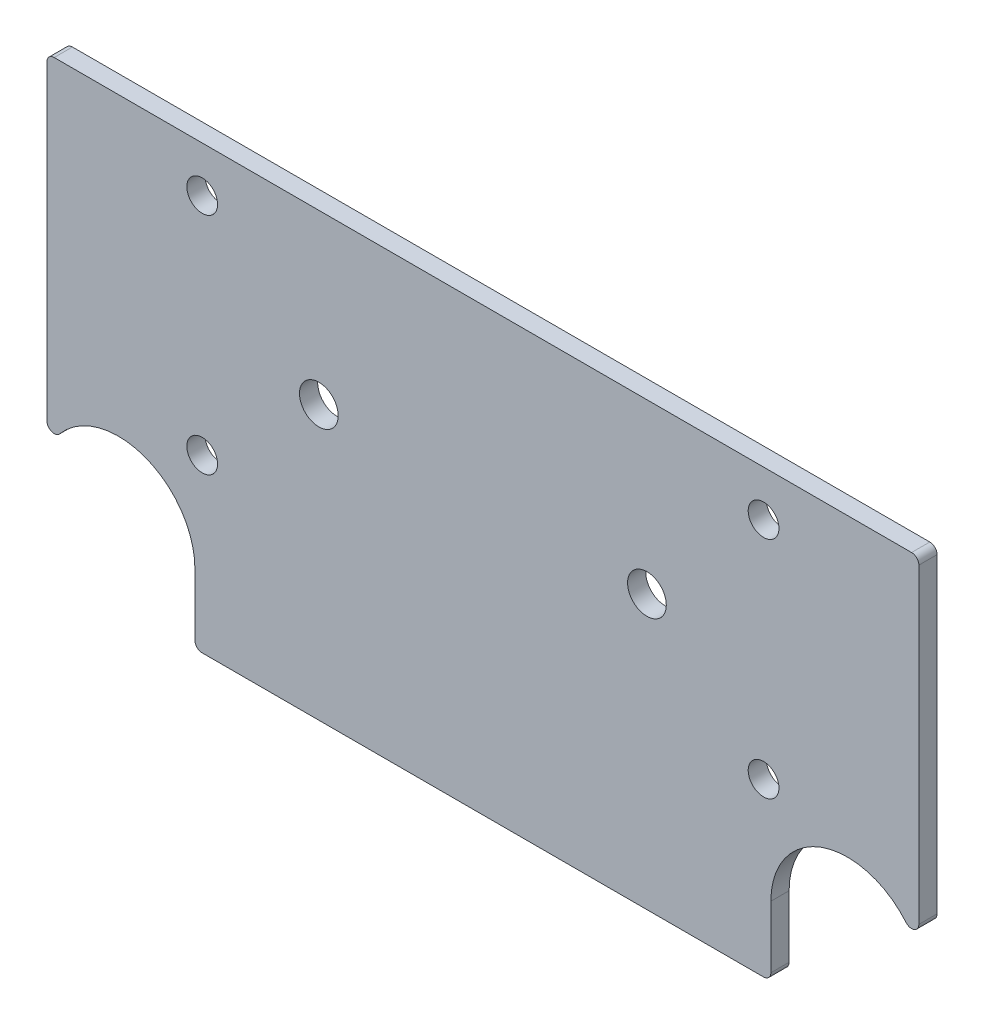
from build123d import *

# Parameters (mm, degrees)
BOSS_EXTRUDE1_DEPTH              = 6.35
CUT_EXTRUDE1_DEPTH               = 221.472033966
F_27_64_0_42188_DIAMETER_HOLE1_D = 10.715752
FILLET1_R                        = 2.54
F_1_2_CLEARANCE_HOLE1_D          = 13.49248


with BuildPart() as part:
    # Sketch1 → Boss-Extrude1 (new body)
    with BuildSketch(Plane.XY):
        with BuildLine():
            Line((-179.07, -25.4), (-179.07, 128.45828257))
            Line((-179.07, 128.45828257), (179.07, 128.45828257))
            Line((179.07, 128.45828257), (179.07, -25.4))
            Line((179.07, -25.4), (153.67, -25.4))
            Line((153.67, -25.4), (153.67, -1.27))
            ThreePointArc((153.67, -1.27), (127, 25.4), (100.33, -1.27))
            Line((100.33, -1.27), (100.33, -25.4))
            Line((100.33, -25.4), (-100.33, -25.4))
            Line((-100.33, -25.4), (-100.33, -1.27))
            ThreePointArc((-100.33, -1.27), (-127, 25.4), (-153.67, -1.27))
            Line((-153.67, -1.27), (-153.67, -25.4))
            Line((-153.67, -25.4), (-179.07, -25.4))
        make_face()
    extrude(amount=BOSS_EXTRUDE1_DEPTH)

    # Sketch7 → Cut-Extrude1 (cut, through all)
    with BuildSketch(Plane(origin=(0, 0, 0), x_dir=(-1, 0, 0), z_dir=(0, 0, -1))):
        with BuildLine():
            Line((-151.892, 128.45828257), (-151.892, 8.304823027))
            ThreePointArc((-151.892, 8.304823027), (-153.22173278, 3.599253536), (-153.67, -1.27))
            Line((-153.67, -1.27), (-153.67, -25.4))
            Line((-153.67, -25.4), (-179.07, -25.4))
            Line((-179.07, -25.4), (-179.07, 128.45828257))
            Line((-179.07, 128.45828257), (-151.892, 128.45828257))
        make_face()
        with BuildLine():
            Line((153.67, -25.4), (153.67, -1.27))
            ThreePointArc((153.67, -1.27), (153.22173278, 3.599253536), (151.892, 8.304823027))
            Line((151.892, 8.304823027), (151.892, 128.45828257))
            Line((151.892, 128.45828257), (179.07, 128.45828257))
            Line((179.07, 128.45828257), (179.07, -25.4))
            Line((179.07, -25.4), (153.67, -25.4))
        make_face()
    extrude(amount=-CUT_EXTRUDE1_DEPTH, mode=Mode.SUBTRACT)

    # 27/64 (0.42188) Diameter Hole1 (through all)
    with Locations(Plane.XY.offset(6.35)):
        with Locations((-97.79, 34.29), (-97.79, 112.58328257), (97.79, 34.29), (97.79, 112.58328257)):
            Hole(F_27_64_0_42188_DIAMETER_HOLE1_D / 2)

    # Fillet1
    fillet1_edges = [part.edges().sort_by_distance(p)[0] for p in [
        (100.33, -25.4, 3.175),
        (-100.33, -25.4, 3.175),
        (151.892, 128.45828257, 3.175),
        (151.892, 8.304823027, 3.175),
        (-151.892, 8.304823027, 3.175),
        (-151.892, 128.45828257, 3.175),
    ]]
    fillet(fillet1_edges, radius=FILLET1_R)

    # 1/2 Clearance Hole1 (through all)
    with Locations(Plane.XY.offset(6.35)):
        with Locations((57.15, 69.85), (-57.15, 69.85)):
            Hole(F_1_2_CLEARANCE_HOLE1_D / 2)


solid = part.part
